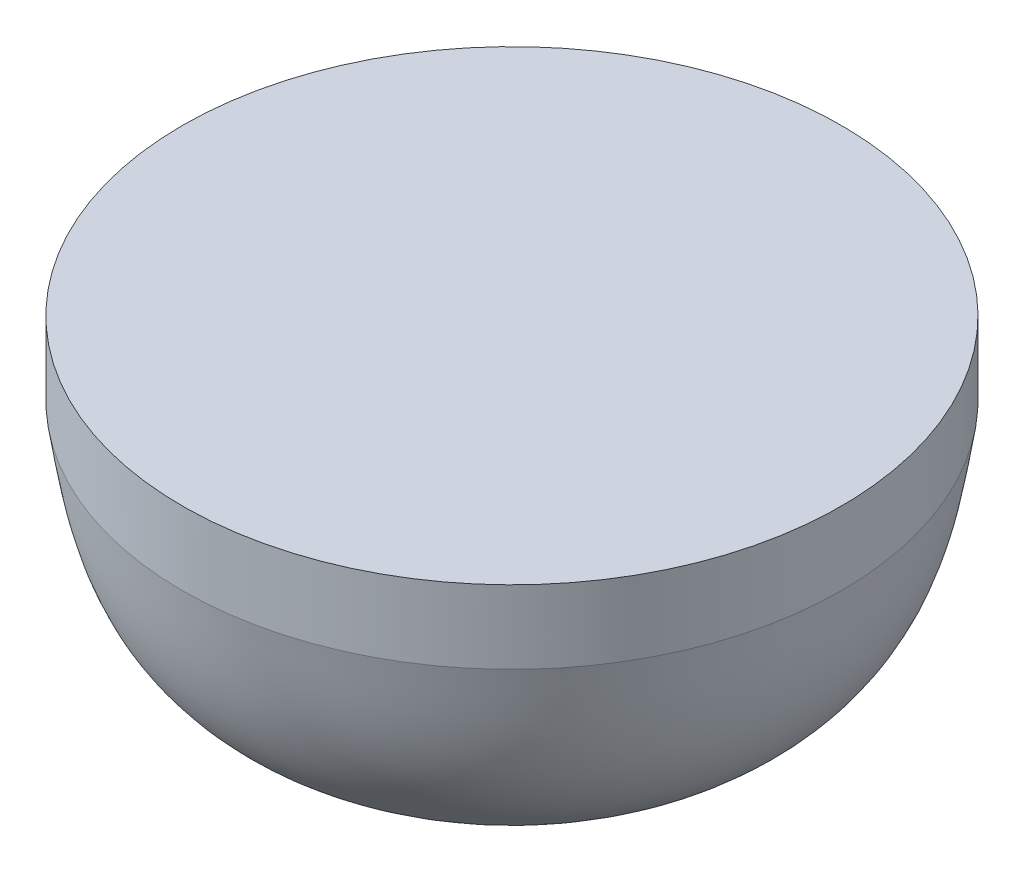
from build123d import *


with BuildPart() as part:
    # Sketch1 → Revolve1 (revolve)
    with BuildSketch(Plane.XY, mode=Mode.PRIVATE) as revolve1_sk:
        with BuildLine():
            Line((0, 0), (0, -14))
            add(Edge.make_bspline(
                [(0, -14), (16.389539142, -14), (17.019517421, -6.054809845), (18, 0)],
                knots=[0, 0, 0, 0, 1, 1, 1, 1], degree=3))
            Line((18, 0), (18, 4))
            Line((18, 4), (0, 4))
            Line((0, 4), (0, 0))
        make_face()
    revolve(revolve1_sk.sketch.rotate(Axis((0, 0, 0), (0, -1, 0)), 180), axis=Axis((0, 0, 0), (0, -1, 0)))


solid = part.part
